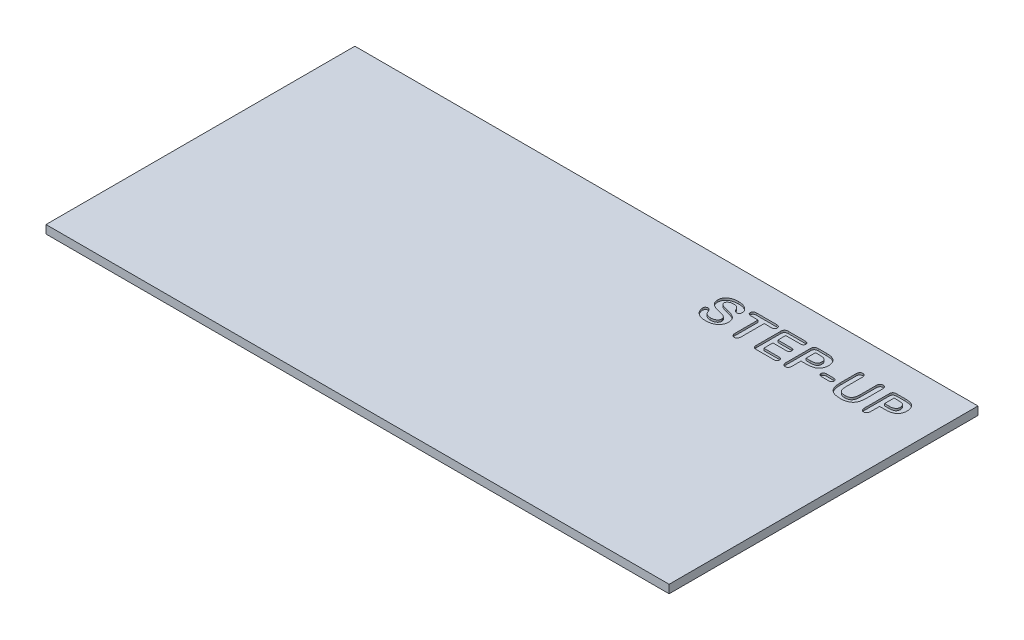
from build123d import *

# Parameters (mm, degrees)
SKETCH1_W           = 150.7
SKETCH1_H           = 74.7
BOSS_EXTRUDE1_DEPTH = 2
CUT_EXTRUDE1_DEPTH  = 0.5


with BuildPart() as part:
    # Sketch1 → Boss-Extrude1 (new body)
    with BuildSketch(Plane(origin=(0, 0, 0), x_dir=(1, 0, 0), z_dir=(0, 1, 0))):
        Rectangle(SKETCH1_W, SKETCH1_H)
    extrude(amount=BOSS_EXTRUDE1_DEPTH)

    # Sketch2 → Cut-Extrude1 (cut)
    # profile 1 of 7: a face of its own
    with BuildSketch(Plane(origin=(0, 2, 0), x_dir=(1, 0, 0), z_dir=(0, 1, 0))):
        with BuildLine():
            Line((64.9625, 25.35), (63.55, 25.35))
            Line((63.55, 25.35), (63.55, 23.1921875))
            add(Edge.make_bspline(
                [(63.55, 23.1921875), (63.548200493, 23.119553799), (63.544788762, 22.981845714), (63.503656267, 22.789754898), (63.438892767, 22.623191348), (63.343819995, 22.487977184), (63.229997001, 22.381456695), (63.100885183, 22.303970658), (62.955999187, 22.259075958), (62.854995107, 22.253079466), (62.803125, 22.25)],
                knots=[0, 0, 0, 0, 1.285699921, 2.437591255, 3.464765735, 4.43309728, 5.341309432, 6.21076238, 7.081146562, 8, 8, 8, 8], degree=3))
            add(Edge.make_bspline(
                [(62.803125, 22.25), (62.74920039, 22.25308367), (62.644665648, 22.259061472), (62.49525059, 22.303168577), (62.3646508, 22.381189563), (62.249753978, 22.485376136), (62.157922353, 22.621124369), (62.094932711, 22.786244519), (62.055618623, 22.977329663), (62.051941587, 23.113850396), (62.05, 23.1859375)],
                knots=[0, 0, 0, 0, 0.952842406, 1.847118322, 2.721986042, 3.621319613, 4.568808427, 5.589565879, 6.727217387, 8, 8, 8, 8], degree=3))
            Line((62.05, 23.1859375), (62.05, 29.0984375))
            add(Edge.make_bspline(
                [(62.05, 29.0984375), (62.050434667, 29.139608427), (62.0512727, 29.21898564), (62.062327203, 29.333930516), (62.08086024, 29.439407853), (62.105682781, 29.536376014), (62.138079603, 29.623387448), (62.177706769, 29.701635998), (62.22437909, 29.770996609), (62.299063449, 29.851444993), (62.41546226, 29.935667862), (62.587166731, 30.003137704), (62.791402515, 30.043149973), (62.93833711, 30.04760778), (63.0171875, 30.05)],
                knots=[0, 0, 0, 0, 0.941718592, 1.815625801, 2.638480297, 3.389986758, 4.102699286, 4.758224476, 5.39283612, 6.008479495, 7.262224214, 8.640906231, 10.197389428, 12, 12, 12, 12], degree=3))
            Line((63.0171875, 30.05), (64.9765625, 30.05))
            add(Edge.make_bspline(
                [(64.9765625, 30.05), (65.046885364, 30.050013455), (65.183413246, 30.050039576), (65.381864387, 30.041288336), (65.567823597, 30.030450008), (65.741539924, 30.017469246), (65.902575257, 29.996991538), (66.050940464, 29.971621683), (66.187435961, 29.944721416), (66.27304116, 29.920825659), (66.3140625, 29.909375)],
                knots=[0, 0, 0, 0, 1.25088383, 2.428520539, 3.533027188, 4.564878591, 5.52680176, 6.419426011, 7.242601342, 8, 8, 8, 8], degree=3))
            add(Edge.make_bspline(
                [(66.3140625, 29.909375), (66.391831182, 29.885701169), (66.544819816, 29.839129374), (66.759841039, 29.738291119), (66.960749687, 29.619783515), (67.142975398, 29.476979443), (67.307320214, 29.31631811), (67.451281035, 29.137644144), (67.573737953, 28.941529386), (67.672789956, 28.727866816), (67.753731375, 28.500678457), (67.80876307, 28.258345702), (67.844578429, 28.002635527), (67.848165585, 27.827209916), (67.85, 27.7375)],
                knots=[0, 0, 0, 0, 1.016072159, 1.998844374, 2.963446839, 3.929479405, 4.88809646, 5.833686282, 6.79396355, 7.773575509, 8.775354313, 9.806098629, 10.878073131, 12, 12, 12, 12], degree=3))
            add(Edge.make_bspline(
                [(67.85, 27.7375), (67.848186591, 27.642588542), (67.844656602, 27.457833472), (67.809027556, 27.189608653), (67.754167819, 26.938409246), (67.673971613, 26.705062612), (67.570735045, 26.489962685), (67.44453727, 26.292889672), (67.296562281, 26.11299441), (67.125271534, 25.951541605), (66.931471429, 25.80885839), (66.715953073, 25.68420262), (66.476441427, 25.582534423), (66.216587393, 25.49561129), (65.933667251, 25.431753168), (65.630083605, 25.382767901), (65.303639546, 25.355079804), (65.078696582, 25.351730247), (64.9625, 25.35)],
                knots=[0, 0, 0, 0, 1.064269092, 2.071710987, 3.030014155, 3.944730477, 4.833317459, 5.700512996, 6.563900655, 7.440202656, 8.334248487, 9.258341999, 10.226640684, 11.248485432, 12.328534365, 13.476518405, 14.696469853, 16, 16, 16, 16], degree=3))
        make_face()
        with BuildLine():
            Line((64.5890625, 28.85), (63.55, 28.85))
            Line((63.55, 28.85), (63.55, 26.55))
            Line((63.55, 26.55), (64.5890625, 26.55))
            add(Edge.make_bspline(
                [(64.5890625, 26.55), (64.676070383, 26.551701706), (64.843043468, 26.554967377), (65.082931449, 26.574020081), (65.300040332, 26.610341656), (65.49605889, 26.657165272), (65.670243096, 26.722262649), (65.822012102, 26.807760466), (65.953696498, 26.909121862), (66.061873063, 27.030552878), (66.148810172, 27.170396855), (66.206396621, 27.331876128), (66.243628028, 27.511853773), (66.247807464, 27.638335228), (66.25, 27.7046875)],
                knots=[0, 0, 0, 0, 1.355309994, 2.600917123, 3.743816141, 4.780660951, 5.735811607, 6.62931006, 7.484500426, 8.311764707, 9.149305958, 10.032284453, 10.967734859, 12, 12, 12, 12], degree=3))
            add(Edge.make_bspline(
                [(66.25, 27.7046875), (66.246635767, 27.784236925), (66.240151616, 27.937558781), (66.183568457, 28.155808259), (66.092761579, 28.353435042), (66.000599113, 28.461694511), (65.9546875, 28.515625)],
                knots=[0, 0, 0, 0, 1.078100798, 2.07790835, 3.042491687, 4, 4, 4, 4], degree=3))
            add(Edge.make_bspline(
                [(65.9546875, 28.515625), (65.924222731, 28.542689382), (65.860176417, 28.599587036), (65.742183143, 28.668263818), (65.601578334, 28.722138275), (65.441841732, 28.772069922), (65.259228002, 28.80584623), (65.055373925, 28.832726413), (64.829392506, 28.847855134), (64.67137475, 28.84926539), (64.5890625, 28.85)],
                knots=[0, 0, 0, 0, 0.67948794, 1.428492636, 2.263733299, 3.191206897, 4.220047442, 5.360670486, 6.625159889, 8, 8, 8, 8], degree=3))
        make_face(mode=Mode.SUBTRACT)
    # profile 2 of 7: a face of its own
    with BuildSketch(Plane(origin=(0, 2, 0), x_dir=(1, 0, 0), z_dir=(0, 1, 0))):
        with BuildLine():
            Line((53.85, 25.5796875), (53.85, 29.3))
            add(Edge.make_bspline(
                [(53.85, 29.3), (53.851843337, 29.374703141), (53.855302094, 29.514872867), (53.895043837, 29.710478107), (53.9572346, 29.877839566), (54.048708577, 30.014282734), (54.160376365, 30.120863014), (54.290957011, 30.195505708), (54.43627969, 30.243580109), (54.539191938, 30.247817776), (54.5921875, 30.25)],
                knots=[0, 0, 0, 0, 1.314006093, 2.465543923, 3.499702682, 4.438645347, 5.334276599, 6.193453487, 7.069703068, 8, 8, 8, 8], degree=3))
            add(Edge.make_bspline(
                [(54.5921875, 30.25), (54.647696923, 30.247019113), (54.75434206, 30.241292211), (54.906078408, 30.196654979), (55.03863166, 30.119805154), (55.151862713, 30.012642849), (55.242251942, 29.874882751), (55.305559719, 29.706490917), (55.344345412, 29.509567433), (55.348043426, 29.368426143), (55.35, 29.29375)],
                knots=[0, 0, 0, 0, 0.96282878, 1.849794185, 2.716851436, 3.599658085, 4.532680285, 5.552030856, 6.704809248, 8, 8, 8, 8], degree=3))
            Line((55.35, 29.29375), (55.35, 25.4640625))
            add(Edge.make_bspline(
                [(55.35, 25.4640625), (55.351774944, 25.359317966), (55.355172118, 25.158841047), (55.381436232, 24.870977327), (55.425807431, 24.609966187), (55.488449908, 24.374193544), (55.576152206, 24.163578501), (55.692749212, 23.97809142), (55.838921849, 23.818102308), (55.982977116, 23.706242941), (56.112687698, 23.632228614), (56.220590251, 23.583609025), (56.337244192, 23.540918823), (56.464340153, 23.509597541), (56.599200895, 23.482092162), (56.743928053, 23.464454093), (56.897657465, 23.450796574), (57.003611758, 23.450269582), (57.0578125, 23.45)],
                knots=[0, 0, 0, 0, 1.640841622, 3.140506311, 4.523579023, 5.784571649, 6.954579444, 8.084197464, 9.198982671, 10.333306227, 10.925380769, 11.535182691, 12.185613052, 12.868404783, 13.583722754, 14.340779317, 15.151228418, 16, 16, 16, 16], degree=3))
            add(Edge.make_bspline(
                [(57.0578125, 23.45), (57.132370733, 23.4513211), (57.276152586, 23.453868775), (57.482935436, 23.478269701), (57.67350243, 23.513929984), (57.846038059, 23.569352845), (58.002792891, 23.637953053), (58.142363883, 23.722119601), (58.265357081, 23.822220398), (58.370819619, 23.938977332), (58.459823018, 24.072767325), (58.538568024, 24.220075314), (58.603472124, 24.383969802), (58.658394028, 24.562521521), (58.700247878, 24.757535373), (58.729253717, 24.968013241), (58.746334888, 25.194509366), (58.748749718, 25.350490531), (58.75, 25.43125)],
                knots=[0, 0, 0, 0, 1.187087794, 2.289239917, 3.312641325, 4.270309596, 5.169103343, 6.032749862, 6.858132282, 7.686303516, 8.528484611, 9.411791075, 10.342302716, 11.33164497, 12.384483705, 13.515514569, 14.713654137, 16, 16, 16, 16], degree=3))
            Line((58.75, 25.43125), (58.75, 29.29375))
            add(Edge.make_bspline(
                [(58.75, 29.29375), (58.752103548, 29.369433717), (58.756050818, 29.511452837), (58.792439742, 29.709785669), (58.856041421, 29.877362487), (58.945463654, 30.014086516), (59.056050082, 30.121820166), (59.18760046, 30.195027826), (59.334100739, 30.243996207), (59.438117705, 30.247946546), (59.4921875, 30.25)],
                knots=[0, 0, 0, 0, 1.324209478, 2.484855026, 3.512713035, 4.440887327, 5.324452051, 6.186293477, 7.057204391, 8, 8, 8, 8], degree=3))
            add(Edge.make_bspline(
                [(59.4921875, 30.25), (59.546217347, 30.247815887), (59.651154252, 30.243573897), (59.799525872, 30.195531154), (59.932599225, 30.121409666), (60.046892769, 30.015500909), (60.141288031, 29.880021364), (60.205762319, 29.711383258), (60.244372526, 29.513736518), (60.248048647, 29.372072739), (60.25, 29.296875)],
                knots=[0, 0, 0, 0, 0.937671153, 1.821147261, 2.686184232, 3.571984669, 4.510357278, 5.535961965, 6.692043289, 8, 8, 8, 8], degree=3))
            Line((60.25, 29.296875), (60.25, 25.5625))
            add(Edge.make_bspline(
                [(60.25, 25.5625), (60.247896087, 25.417136545), (60.243856429, 25.138028666), (60.213572353, 24.738116806), (60.160619704, 24.375823771), (60.089048273, 24.046643352), (59.985211843, 23.744758349), (59.842423333, 23.465424496), (59.66296704, 23.203815396), (59.516271864, 23.049704479), (59.4421875, 22.971875)],
                knots=[0, 0, 0, 0, 1.248457049, 2.397123805, 3.441600438, 4.391152342, 5.286682789, 6.174943873, 7.078305605, 8, 8, 8, 8], degree=3))
            add(Edge.make_bspline(
                [(59.4421875, 22.971875), (59.371093093, 22.911812763), (59.229070693, 22.791828879), (58.992406933, 22.642737173), (58.740548023, 22.516074488), (58.470029614, 22.416084523), (58.179287903, 22.341240921), (57.866615872, 22.289261711), (57.530936875, 22.255710642), (57.299042666, 22.251940486), (57.1796875, 22.25)],
                knots=[0, 0, 0, 0, 0.917673777, 1.83319953, 2.752815171, 3.696261941, 4.673826777, 5.7116717, 6.822205161, 8, 8, 8, 8], degree=3))
            add(Edge.make_bspline(
                [(57.1796875, 22.25), (57.037934366, 22.252312684), (56.764362257, 22.256775978), (56.369211286, 22.293274114), (56.004144416, 22.350814054), (55.669385632, 22.435267527), (55.363186307, 22.543112744), (55.088641097, 22.682513803), (54.839596471, 22.842820489), (54.622239148, 23.034364877), (54.432784837, 23.252527622), (54.270062759, 23.498498653), (54.138742697, 23.77450846), (54.029268658, 24.077191703), (53.950736271, 24.410481931), (53.890683283, 24.772633299), (53.857481503, 25.166052574), (53.852553985, 25.43848362), (53.85, 25.5796875)],
                knots=[0, 0, 0, 0, 1.244583114, 2.401944964, 3.48169555, 4.486712429, 5.430003149, 6.325898902, 7.184706889, 8.024138875, 8.860562605, 9.715550095, 10.605366032, 11.538500779, 12.536866304, 13.60758979, 14.759988597, 16, 16, 16, 16], degree=3))
        make_face()
    # profile 3 of 7: a face of its own
    with BuildSketch(Plane(origin=(0, 2, 0), x_dir=(1, 0, 0), z_dir=(0, 1, 0))):
        with BuildLine():
            Line((51.978125, 24.55), (50.321875, 24.55))
            add(Edge.make_bspline(
                [(50.321875, 24.55), (50.262325989, 24.551903263), (50.150117822, 24.555489581), (49.993008655, 24.587020776), (49.856901719, 24.637125092), (49.746189928, 24.712209311), (49.658152828, 24.801878549), (49.595993321, 24.906479399), (49.556591176, 25.022779858), (49.552229926, 25.104891152), (49.55, 25.146875)],
                knots=[0, 0, 0, 0, 1.299805928, 2.449223535, 3.486898841, 4.446433637, 5.347856832, 6.21051608, 7.085029387, 8, 8, 8, 8], degree=3))
            add(Edge.make_bspline(
                [(49.55, 25.146875), (49.552355315, 25.189843141), (49.556925941, 25.27322531), (49.593749185, 25.39155723), (49.65554407, 25.495965726), (49.73918911, 25.588263853), (49.849908062, 25.663490392), (49.986824065, 25.712869249), (50.146462016, 25.744735894), (50.260757015, 25.748165862), (50.321875, 25.75)],
                knots=[0, 0, 0, 0, 0.930252909, 1.805209739, 2.655335837, 3.542447437, 4.485088836, 5.525143206, 6.676597728, 8, 8, 8, 8], degree=3))
            Line((50.321875, 25.75), (51.978125, 25.75))
            add(Edge.make_bspline(
                [(51.978125, 25.75), (52.039236604, 25.748143103), (52.15351967, 25.744670574), (52.312757112, 25.713177265), (52.448988312, 25.6631708), (52.559208584, 25.58777455), (52.644544874, 25.496517209), (52.706178204, 25.391491218), (52.743093788, 25.273243246), (52.747651394, 25.18984924), (52.75, 25.146875)],
                knots=[0, 0, 0, 0, 1.32387857, 2.475747504, 3.505638844, 4.448619502, 5.343708498, 6.194140559, 7.06941229, 8, 8, 8, 8], degree=3))
            add(Edge.make_bspline(
                [(52.75, 25.146875), (52.747456291, 25.104987728), (52.742500363, 25.023378415), (52.707796904, 24.906261858), (52.646392865, 24.802581798), (52.561812167, 24.71173251), (52.452082557, 24.636866251), (52.315421275, 24.586569432), (52.155050269, 24.55539333), (52.039749514, 24.551878541), (51.978125, 24.55)],
                knots=[0, 0, 0, 0, 0.911547891, 1.775976195, 2.629630521, 3.512087315, 4.458640903, 5.492434473, 6.659787555, 8, 8, 8, 8], degree=3))
        make_face()
    # profile 4 of 7: a face of its own
    with BuildSketch(Plane(origin=(0, 2, 0), x_dir=(1, 0, 0), z_dir=(0, 1, 0))):
        with BuildLine():
            Line((45.9625, 25.35), (44.55, 25.35))
            Line((44.55, 25.35), (44.55, 23.1921875))
            add(Edge.make_bspline(
                [(44.55, 23.1921875), (44.548200493, 23.119553799), (44.544788762, 22.981845714), (44.503656267, 22.789754898), (44.438892767, 22.623191348), (44.343819995, 22.487977184), (44.229997001, 22.381456695), (44.100885183, 22.303970658), (43.955999187, 22.259075958), (43.854995107, 22.253079466), (43.803125, 22.25)],
                knots=[0, 0, 0, 0, 1.285699921, 2.437591255, 3.464765735, 4.43309728, 5.341309432, 6.21076238, 7.081146562, 8, 8, 8, 8], degree=3))
            add(Edge.make_bspline(
                [(43.803125, 22.25), (43.74920039, 22.25308367), (43.644665648, 22.259061472), (43.49525059, 22.303168577), (43.3646508, 22.381189563), (43.249753978, 22.485376136), (43.157922353, 22.621124369), (43.094932711, 22.786244519), (43.055618623, 22.977329663), (43.051941587, 23.113850396), (43.05, 23.1859375)],
                knots=[0, 0, 0, 0, 0.952842406, 1.847118322, 2.721986042, 3.621319613, 4.568808427, 5.589565879, 6.727217387, 8, 8, 8, 8], degree=3))
            Line((43.05, 23.1859375), (43.05, 29.0984375))
            add(Edge.make_bspline(
                [(43.05, 29.0984375), (43.050434667, 29.139608427), (43.0512727, 29.21898564), (43.062327203, 29.333930516), (43.08086024, 29.439407853), (43.105682781, 29.536376014), (43.138079603, 29.623387448), (43.177706769, 29.701635998), (43.22437909, 29.770996609), (43.299063449, 29.851444993), (43.41546226, 29.935667862), (43.587166731, 30.003137704), (43.791402515, 30.043149973), (43.93833711, 30.04760778), (44.0171875, 30.05)],
                knots=[0, 0, 0, 0, 0.941718592, 1.815625801, 2.638480297, 3.389986758, 4.102699286, 4.758224476, 5.39283612, 6.008479495, 7.262224214, 8.640906231, 10.197389428, 12, 12, 12, 12], degree=3))
            Line((44.0171875, 30.05), (45.9765625, 30.05))
            add(Edge.make_bspline(
                [(45.9765625, 30.05), (46.046885364, 30.050013455), (46.183413246, 30.050039576), (46.381864387, 30.041288336), (46.567823597, 30.030450008), (46.741539924, 30.017469246), (46.902575257, 29.996991538), (47.050940464, 29.971621683), (47.187435961, 29.944721416), (47.27304116, 29.920825659), (47.3140625, 29.909375)],
                knots=[0, 0, 0, 0, 1.25088383, 2.428520539, 3.533027188, 4.564878591, 5.52680176, 6.419426011, 7.242601342, 8, 8, 8, 8], degree=3))
            add(Edge.make_bspline(
                [(47.3140625, 29.909375), (47.391831182, 29.885701169), (47.544819816, 29.839129374), (47.759841039, 29.738291119), (47.960749687, 29.619783515), (48.142975398, 29.476979443), (48.307320214, 29.31631811), (48.451281035, 29.137644144), (48.573737953, 28.941529386), (48.672789956, 28.727866816), (48.753731375, 28.500678457), (48.80876307, 28.258345702), (48.844578429, 28.002635527), (48.848165585, 27.827209916), (48.85, 27.7375)],
                knots=[0, 0, 0, 0, 1.016072159, 1.998844374, 2.963446839, 3.929479405, 4.88809646, 5.833686282, 6.79396355, 7.773575509, 8.775354313, 9.806098629, 10.878073131, 12, 12, 12, 12], degree=3))
            add(Edge.make_bspline(
                [(48.85, 27.7375), (48.848186591, 27.642588542), (48.844656602, 27.457833472), (48.809027556, 27.189608653), (48.754167819, 26.938409246), (48.673971613, 26.705062612), (48.570735045, 26.489962685), (48.44453727, 26.292889672), (48.296562281, 26.11299441), (48.125271534, 25.951541605), (47.931471429, 25.80885839), (47.715953073, 25.68420262), (47.476441427, 25.582534423), (47.216587393, 25.49561129), (46.933667251, 25.431753168), (46.630083605, 25.382767901), (46.303639546, 25.355079804), (46.078696582, 25.351730247), (45.9625, 25.35)],
                knots=[0, 0, 0, 0, 1.064269092, 2.071710987, 3.030014155, 3.944730477, 4.833317459, 5.700512996, 6.563900655, 7.440202656, 8.334248487, 9.258341999, 10.226640684, 11.248485432, 12.328534365, 13.476518405, 14.696469853, 16, 16, 16, 16], degree=3))
        make_face()
        with BuildLine():
            Line((45.5890625, 28.85), (44.55, 28.85))
            Line((44.55, 28.85), (44.55, 26.55))
            Line((44.55, 26.55), (45.5890625, 26.55))
            add(Edge.make_bspline(
                [(45.5890625, 26.55), (45.676070383, 26.551701706), (45.843043468, 26.554967377), (46.082931449, 26.574020081), (46.300040332, 26.610341656), (46.49605889, 26.657165272), (46.670243096, 26.722262649), (46.822012102, 26.807760466), (46.953696498, 26.909121862), (47.061873063, 27.030552878), (47.148810172, 27.170396855), (47.206396621, 27.331876128), (47.243628028, 27.511853773), (47.247807464, 27.638335228), (47.25, 27.7046875)],
                knots=[0, 0, 0, 0, 1.355309994, 2.600917123, 3.743816141, 4.780660951, 5.735811607, 6.62931006, 7.484500426, 8.311764707, 9.149305958, 10.032284453, 10.967734859, 12, 12, 12, 12], degree=3))
            add(Edge.make_bspline(
                [(47.25, 27.7046875), (47.246635767, 27.784236925), (47.240151616, 27.937558781), (47.183568457, 28.155808259), (47.092761579, 28.353435042), (47.000599113, 28.461694511), (46.9546875, 28.515625)],
                knots=[0, 0, 0, 0, 1.078100798, 2.07790835, 3.042491687, 4, 4, 4, 4], degree=3))
            add(Edge.make_bspline(
                [(46.9546875, 28.515625), (46.924222731, 28.542689382), (46.860176417, 28.599587036), (46.742183143, 28.668263818), (46.601578334, 28.722138275), (46.441841732, 28.772069922), (46.259228002, 28.80584623), (46.055373925, 28.832726413), (45.829392506, 28.847855134), (45.67137475, 28.84926539), (45.5890625, 28.85)],
                knots=[0, 0, 0, 0, 0.67948794, 1.428492636, 2.263733299, 3.191206897, 4.220047442, 5.360670486, 6.625159889, 8, 8, 8, 8], degree=3))
        make_face(mode=Mode.SUBTRACT)
    # profile 5 of 7: a face of its own
    with BuildSketch(Plane(origin=(0, 2, 0), x_dir=(1, 0, 0), z_dir=(0, 1, 0))):
        with BuildLine():
            Line((40.878125, 28.85), (37.35, 28.85))
            Line((37.35, 28.85), (37.35, 26.95))
            Line((37.35, 26.95), (40.5984375, 26.95))
            add(Edge.make_bspline(
                [(40.5984375, 26.95), (40.654808283, 26.947866606), (40.760619514, 26.943862103), (40.908735191, 26.915536651), (41.033999736, 26.863546668), (41.135907692, 26.790996382), (41.214173465, 26.700761291), (41.271706533, 26.597893551), (41.305341496, 26.480165366), (41.309023021, 26.397615403), (41.3109375, 26.3546875)],
                knots=[0, 0, 0, 0, 1.285293232, 2.412569968, 3.418386025, 4.354403319, 5.23810445, 6.120527863, 7.022630715, 8, 8, 8, 8], degree=3))
            add(Edge.make_bspline(
                [(41.3109375, 26.3546875), (41.309076808, 26.311733294), (41.305498714, 26.22913275), (41.271079409, 26.111555816), (41.215670117, 26.006526708), (41.138153342, 25.914393747), (41.037089175, 25.839168055), (40.911507056, 25.785881982), (40.762348096, 25.755721734), (40.655353341, 25.751986798), (40.5984375, 25.75)],
                knots=[0, 0, 0, 0, 0.971200242, 1.867609123, 2.749214551, 3.645234956, 4.57279535, 5.576919765, 6.711042891, 8, 8, 8, 8], degree=3))
            Line((40.5984375, 25.75), (37.35, 25.75))
            Line((37.35, 25.75), (37.35, 23.55))
            Line((37.35, 23.55), (41, 23.55))
            add(Edge.make_bspline(
                [(41, 23.55), (41.057921056, 23.547832714), (41.166806448, 23.543758448), (41.320281315, 23.515623535), (41.450341207, 23.4621797), (41.557739329, 23.389015476), (41.642612592, 23.299215593), (41.700991963, 23.192434212), (41.73891324, 23.073371804), (41.742105854, 22.988843341), (41.74375, 22.9453125)],
                knots=[0, 0, 0, 0, 1.281412047, 2.408917619, 3.431661904, 4.368016538, 5.264760761, 6.136510243, 7.040331808, 8, 8, 8, 8], degree=3))
            add(Edge.make_bspline(
                [(41.74375, 22.9453125), (41.742191646, 22.90278967), (41.739184528, 22.820734408), (41.70030769, 22.705092373), (41.642190584, 22.60050829), (41.557722269, 22.511097277), (41.450702936, 22.437376187), (41.31967536, 22.386877569), (41.167095907, 22.35549324), (41.057985531, 22.351906261), (41, 22.35)],
                knots=[0, 0, 0, 0, 0.944744106, 1.823049547, 2.692159438, 3.596595969, 4.540982691, 5.5681055, 6.707595947, 8, 8, 8, 8], degree=3))
            Line((41, 22.35), (36.76875, 22.35))
            add(Edge.make_bspline(
                [(36.76875, 22.35), (36.692475037, 22.352219706), (36.550535707, 22.356350336), (36.353879542, 22.398310057), (36.18996276, 22.467712994), (36.05747362, 22.569815024), (35.961692234, 22.708460997), (35.894820923, 22.878233228), (35.857526723, 23.081749071), (35.852624476, 23.227969299), (35.85, 23.30625)],
                knots=[0, 0, 0, 0, 1.189456171, 2.21344733, 3.119993849, 3.948013107, 4.78741338, 5.71757596, 6.778077714, 8, 8, 8, 8], degree=3))
            Line((35.85, 23.30625), (35.85, 29.09375))
            add(Edge.make_bspline(
                [(35.85, 29.09375), (35.851201262, 29.147445357), (35.853482324, 29.249406838), (35.870448113, 29.394954422), (35.899314995, 29.525262549), (35.941782749, 29.640932339), (35.996000542, 29.742745589), (36.066313479, 29.828913881), (36.150345927, 29.899741117), (36.247397964, 29.957205241), (36.358881578, 29.998291889), (36.482794666, 30.030258142), (36.62146653, 30.046211421), (36.71819793, 30.048699647), (36.76875, 30.05)],
                knots=[0, 0, 0, 0, 1.257097402, 2.387087425, 3.425508426, 4.374733264, 5.264346199, 6.113849079, 6.961774747, 7.825601221, 8.740599092, 9.73444991, 10.816017894, 12, 12, 12, 12], degree=3))
            Line((36.76875, 30.05), (40.878125, 30.05))
            add(Edge.make_bspline(
                [(40.878125, 30.05), (40.936547132, 30.047786723), (41.046428114, 30.043623967), (41.20070829, 30.016198256), (41.329929303, 29.962007982), (41.436282782, 29.889626428), (41.516268309, 29.798524894), (41.577029837, 29.695816642), (41.6115646, 29.57819476), (41.615281148, 29.495527854), (41.6171875, 29.453125)],
                knots=[0, 0, 0, 0, 1.304353081, 2.453241492, 3.474309848, 4.409392115, 5.298405909, 6.157667996, 7.055001114, 8, 8, 8, 8], degree=3))
            add(Edge.make_bspline(
                [(41.6171875, 29.453125), (41.615355602, 29.409658237), (41.61180473, 29.325404151), (41.576561889, 29.205598616), (41.517302813, 29.100325512), (41.436117896, 29.008990145), (41.330317299, 28.936073028), (41.200273997, 28.88431663), (41.046500227, 28.856208719), (40.936572164, 28.852155198), (40.878125, 28.85)],
                knots=[0, 0, 0, 0, 0.962139494, 1.864969442, 2.738963821, 3.622448103, 4.551714319, 5.562017248, 6.70375977, 8, 8, 8, 8], degree=3))
        make_face()
    # profile 6 of 7: a face of its own
    with BuildSketch(Plane(origin=(0, 2, 0), x_dir=(1, 0, 0), z_dir=(0, 1, 0))):
        with BuildLine():
            Line((33.9578125, 28.75), (32.25, 28.75))
            Line((32.25, 28.75), (32.25, 23.19375))
            add(Edge.make_bspline(
                [(32.25, 23.19375), (32.248148683, 23.118535681), (32.244686184, 22.97786313), (32.205288163, 22.781404942), (32.141477772, 22.614492132), (32.048549707, 22.479737946), (31.935904267, 22.375968674), (31.805825861, 22.302721538), (31.66031622, 22.256840006), (31.557641248, 22.252327359), (31.5046875, 22.25)],
                knots=[0, 0, 0, 0, 1.324771526, 2.4777063, 3.516495944, 4.454151167, 5.338361256, 6.19400724, 7.068574513, 8, 8, 8, 8], degree=3))
            add(Edge.make_bspline(
                [(31.5046875, 22.25), (31.451142683, 22.252124623), (31.34715597, 22.256250747), (31.200563979, 22.305181765), (31.066914435, 22.376697952), (30.953295254, 22.483117179), (30.858625993, 22.617658023), (30.796912448, 22.785554926), (30.754827435, 22.97968454), (30.751673905, 23.119523156), (30.75, 23.19375)],
                knots=[0, 0, 0, 0, 0.936591527, 1.818907611, 2.686883908, 3.580272073, 4.52668274, 5.549195867, 6.699104295, 8, 8, 8, 8], degree=3))
            Line((30.75, 23.19375), (30.75, 28.75))
            Line((30.75, 28.75), (29.040625, 28.75))
            add(Edge.make_bspline(
                [(29.040625, 28.75), (28.977905618, 28.751556279), (28.860231213, 28.754476178), (28.696906818, 28.789852284), (28.556740423, 28.842988626), (28.443325711, 28.922921396), (28.356539538, 29.021221203), (28.29315205, 29.133869266), (28.257079634, 29.261375609), (28.252406376, 29.350818595), (28.25, 29.396875)],
                knots=[0, 0, 0, 0, 1.298175259, 2.435642608, 3.448405227, 4.386245553, 5.281324188, 6.14672195, 7.045701294, 8, 8, 8, 8], degree=3))
            add(Edge.make_bspline(
                [(28.25, 29.396875), (28.252003331, 29.445113421), (28.255866362, 29.538131793), (28.29667311, 29.668486726), (28.360181417, 29.783764012), (28.451502619, 29.879883878), (28.566220724, 29.95798555), (28.705087679, 30.011772948), (28.865644078, 30.044805548), (28.980029663, 30.048201178), (29.040625, 30.05)],
                knots=[0, 0, 0, 0, 0.993926626, 1.916593339, 2.793690024, 3.692250099, 4.629614642, 5.63892321, 6.749228366, 8, 8, 8, 8], degree=3))
            Line((29.040625, 30.05), (33.9578125, 30.05))
            add(Edge.make_bspline(
                [(33.9578125, 30.05), (34.021559191, 30.048386745), (34.14126913, 30.045357212), (34.307509792, 30.01065929), (34.449519021, 29.955899164), (34.562318061, 29.873323553), (34.652113655, 29.77610947), (34.713727111, 29.661365636), (34.753058231, 29.533799084), (34.757222549, 29.443532148), (34.759375, 29.396875)],
                knots=[0, 0, 0, 0, 1.304496451, 2.449714448, 3.464685333, 4.39788137, 5.28974218, 6.154486031, 7.046091257, 8, 8, 8, 8], degree=3))
            add(Edge.make_bspline(
                [(34.759375, 29.396875), (34.757109889, 29.350784207), (34.752703748, 29.261127431), (34.714520318, 29.133710702), (34.649633141, 29.021124348), (34.561248062, 28.922855601), (34.446290994, 28.842994176), (34.304147791, 28.789615927), (34.139182525, 28.754757885), (34.020516423, 28.751644914), (33.9578125, 28.75)],
                knots=[0, 0, 0, 0, 0.94771637, 1.843517728, 2.708217129, 3.604275273, 4.544436114, 5.560171289, 6.710778986, 8, 8, 8, 8], degree=3))
        make_face()
    # profile 7 of 7: a face of its own
    with BuildSketch(Plane(origin=(0, 2, 0), x_dir=(1, 0, 0), z_dir=(0, 1, 0))):
        with BuildLine():
            add(Edge.make_bspline(
                [(27.65, 24.7453125), (27.648712959, 24.686416555), (27.646167584, 24.569938389), (27.628509982, 24.397671378), (27.600432282, 24.230117752), (27.561760436, 24.066900576), (27.509729615, 23.908872593), (27.446618288, 23.755095981), (27.374141886, 23.60483796), (27.286963065, 23.461035693), (27.191359314, 23.322467836), (27.083620941, 23.191909741), (26.967177823, 23.068069697), (26.837487705, 22.953924206), (26.698793161, 22.846246473), (26.549672126, 22.745719978), (26.389794227, 22.653595024), (26.219786488, 22.56929911), (26.040078479, 22.494579849), (25.852178057, 22.429255194), (25.656559057, 22.371615173), (25.451743436, 22.330133497), (25.239992232, 22.292461342), (25.019167025, 22.268767564), (24.790360918, 22.252150199), (24.634927741, 22.250722618), (24.55625, 22.25)],
                knots=[0, 0, 0, 0, 0.94904565, 1.876922008, 2.787632434, 3.685409961, 4.577243309, 5.465673456, 6.362823001, 7.262481841, 8.172882791, 9.073480814, 9.987781212, 10.909257821, 11.854472834, 12.815908446, 13.804938933, 14.825933836, 15.871877953, 16.938992789, 18.030809531, 19.155177508, 20.304610591, 21.495671913, 22.732349945, 24, 24, 24, 24], degree=3))
            add(Edge.make_bspline(
                [(24.55625, 22.25), (24.462474107, 22.251766251), (24.278349903, 22.255234195), (24.008422299, 22.274556492), (23.751464319, 22.311477218), (23.506290894, 22.358903044), (23.273828062, 22.422704047), (23.054537895, 22.501760385), (22.846183667, 22.590786663), (22.717062091, 22.664875803), (22.653125, 22.7015625)],
                knots=[0, 0, 0, 0, 1.136969792, 2.232382444, 3.278022597, 4.282276305, 5.258039159, 6.196692155, 7.1070566, 8, 8, 8, 8], degree=3))
            add(Edge.make_bspline(
                [(22.653125, 22.7015625), (22.570260974, 22.756212978), (22.405385002, 22.864951971), (22.186628197, 23.066016783), (21.987559492, 23.288021359), (21.818700513, 23.534109002), (21.680389778, 23.790234771), (21.578610118, 24.047893376), (21.515927044, 24.303267459), (21.507331988, 24.473115255), (21.503125, 24.55625)],
                knots=[0, 0, 0, 0, 1.048405233, 2.086029851, 3.131870059, 4.19698972, 5.234628962, 6.204463721, 7.121145791, 8, 8, 8, 8], degree=3))
            add(Edge.make_bspline(
                [(21.503125, 24.55625), (21.505500875, 24.602848128), (21.510141108, 24.693857185), (21.547381887, 24.824573551), (21.608344767, 24.944021763), (21.690355948, 25.051721491), (21.793128258, 25.140577725), (21.911166606, 25.205880141), (22.042625734, 25.247125435), (22.135104417, 25.25108324), (22.1828125, 25.253125)],
                knots=[0, 0, 0, 0, 1.029346977, 2.010378973, 2.978887221, 3.98112847, 4.985683985, 5.960201932, 6.947705008, 8, 8, 8, 8], degree=3))
            add(Edge.make_bspline(
                [(22.1828125, 25.253125), (22.221575716, 25.251619621), (22.296699953, 25.248702153), (22.40454571, 25.217270865), (22.502657412, 25.166744282), (22.591437191, 25.09551993), (22.673327499, 25.00725768), (22.746532653, 24.898385902), (22.815763114, 24.772248143), (22.852619397, 24.678609241), (22.871875, 24.6296875)],
                knots=[0, 0, 0, 0, 0.932433643, 1.807083439, 2.683354794, 3.577798377, 4.537574086, 5.575745438, 6.73344572, 8, 8, 8, 8], degree=3))
            add(Edge.make_bspline(
                [(22.871875, 24.6296875), (22.897469659, 24.570639719), (22.946870812, 24.456669515), (23.025795442, 24.294449777), (23.111430698, 24.149635577), (23.196447405, 24.015142896), (23.295238615, 23.894548966), (23.412669399, 23.788460724), (23.546302728, 23.690824068), (23.699013441, 23.604052653), (23.873699625, 23.532377551), (24.074183049, 23.4863995), (24.297363258, 23.45366496), (24.455069827, 23.451258047), (24.5375, 23.45)],
                knots=[0, 0, 0, 0, 1.049400523, 2.025484958, 2.938775158, 3.791458515, 4.617854192, 5.471340711, 6.364831691, 7.311813007, 8.329001391, 9.430967745, 10.65721654, 12, 12, 12, 12], degree=3))
            add(Edge.make_bspline(
                [(24.5375, 23.45), (24.59587672, 23.450704912), (24.710247005, 23.45208596), (24.877165585, 23.468586082), (25.03616907, 23.492577459), (25.185551379, 23.529496663), (25.328153582, 23.571924491), (25.460753804, 23.629310958), (25.586089269, 23.694350994), (25.701619031, 23.769330441), (25.806253904, 23.851967595), (25.898670489, 23.940259314), (25.976149101, 24.034884402), (26.038816492, 24.134383647), (26.090293015, 24.237455191), (26.123604798, 24.346900673), (26.14753714, 24.460417196), (26.149169013, 24.538409536), (26.15, 24.578125)],
                knots=[0, 0, 0, 0, 1.280104897, 2.507951138, 3.676307556, 4.80418709, 5.881088807, 6.935759984, 7.968101261, 8.975871649, 9.951925376, 10.889226907, 11.77430911, 12.626938706, 13.464975202, 14.292430499, 15.130466995, 16, 16, 16, 16], degree=3))
            add(Edge.make_bspline(
                [(26.15, 24.578125), (26.147163147, 24.639380696), (26.141694677, 24.757460453), (26.095038902, 24.924947316), (26.018954629, 25.074760242), (25.909609626, 25.202901583), (25.778573621, 25.31506696), (25.629577509, 25.413951212), (25.461953745, 25.496363135), (25.275237274, 25.567285702), (25.063175966, 25.629960302), (24.823055091, 25.698226874), (24.549375699, 25.763796465), (24.356287844, 25.807993886), (24.2546875, 25.83125)],
                knots=[0, 0, 0, 0, 0.889216893, 1.714102054, 2.506617733, 3.313297162, 4.145346194, 5.008548814, 5.905982136, 6.85524107, 7.90915739, 9.119934543, 10.484546625, 12, 12, 12, 12], degree=3))
            add(Edge.make_bspline(
                [(24.2546875, 25.83125), (24.121570221, 25.863946459), (23.865384971, 25.926871053), (23.500806312, 26.036170323), (23.170220768, 26.153528031), (22.869789851, 26.276775336), (22.60105202, 26.419257641), (22.361682967, 26.58421778), (22.153358078, 26.774545525), (22.001804853, 26.951223997), (21.899985809, 27.105476199), (21.831932302, 27.227728242), (21.775939149, 27.357687964), (21.730819577, 27.49434549), (21.694924187, 27.636927841), (21.668053724, 27.786141205), (21.652279102, 27.942363632), (21.650768427, 28.048922359), (21.65, 28.103125)],
                knots=[0, 0, 0, 0, 1.736501148, 3.341910126, 4.819600125, 6.179978285, 7.452384316, 8.666026066, 9.852526874, 11.018500134, 11.604160195, 12.191898388, 12.788898658, 13.394048862, 14.013423104, 14.650267458, 15.313438986, 16, 16, 16, 16], degree=3))
            add(Edge.make_bspline(
                [(21.65, 28.103125), (21.650557975, 28.155273407), (21.651660409, 28.258307091), (21.670808909, 28.410511925), (21.695427828, 28.558899226), (21.736279271, 28.701905522), (21.783972236, 28.841228762), (21.843322949, 28.976526062), (21.916120515, 29.105645601), (21.99674673, 29.231389453), (22.089602208, 29.349846173), (22.191405128, 29.463165542), (22.303826104, 29.569173346), (22.42597173, 29.667262016), (22.556413512, 29.759062607), (22.69798423, 29.841681318), (22.849199834, 29.917426381), (23.064954682, 30.013506377), (23.357496699, 30.1091081), (23.733154434, 30.192171103), (24.138353416, 30.240032524), (24.41810321, 30.246606665), (24.5625, 30.25)],
                knots=[0, 0, 0, 0, 0.769447055, 1.520256708, 2.262508943, 2.988321943, 3.713156319, 4.436274914, 5.166110871, 5.89994773, 6.639925254, 7.385953261, 8.147635144, 8.918771606, 9.697541001, 10.500837489, 11.336648996, 12.194084557, 13.986552036, 15.869357873, 17.867910982, 20, 20, 20, 20], degree=3))
            add(Edge.make_bspline(
                [(24.5625, 30.25), (24.677689291, 30.248067381), (24.900233702, 30.244333582), (25.222041094, 30.211050863), (25.51967547, 30.157517899), (25.793210734, 30.081066548), (26.042014979, 29.98376068), (26.272129344, 29.878311201), (26.477092235, 29.751859597), (26.660412441, 29.614448897), (26.820575498, 29.468466537), (26.958089465, 29.317194564), (27.073241338, 29.162762549), (27.163600717, 29.004002626), (27.234733798, 28.846031446), (27.285130506, 28.688867706), (27.316612929, 28.533036891), (27.32013646, 28.429306479), (27.321875, 28.378125)],
                knots=[0, 0, 0, 0, 1.501690988, 2.90125006, 4.213360721, 5.441058994, 6.597662568, 7.694391675, 8.736870916, 9.731158549, 10.678212085, 11.558107852, 12.393499291, 13.184506524, 13.935459515, 14.648542639, 15.3331793, 16, 16, 16, 16], degree=3))
            add(Edge.make_bspline(
                [(27.321875, 28.378125), (27.319432994, 28.332571118), (27.314610545, 28.242611752), (27.276974316, 28.11143357), (27.214868843, 27.988512615), (27.131267051, 27.875619206), (27.030307317, 27.778859958), (26.912963129, 27.708258224), (26.783339159, 27.663619314), (26.692030332, 27.658744289), (26.6453125, 27.65625)],
                knots=[0, 0, 0, 0, 0.996822281, 1.968514991, 2.963507279, 3.999520829, 5.032703306, 6.005199511, 6.979367534, 8, 8, 8, 8], degree=3))
            add(Edge.make_bspline(
                [(26.6453125, 27.65625), (26.604052264, 27.657672268), (26.526093726, 27.660359552), (26.416871985, 27.682201951), (26.322508486, 27.717533855), (26.241790411, 27.770713094), (26.170238395, 27.841485817), (26.099187665, 27.928849367), (26.021725922, 28.031417296), (25.973821219, 28.108928437), (25.9484375, 28.15)],
                knots=[0, 0, 0, 0, 1.091449335, 2.062222683, 2.935356023, 3.742291246, 4.60049062, 5.589116983, 6.722522559, 8, 8, 8, 8], degree=3))
            add(Edge.make_bspline(
                [(25.9484375, 28.15), (25.911821519, 28.225224116), (25.841167488, 28.37037623), (25.715776953, 28.569079862), (25.577208096, 28.739864829), (25.453238141, 28.865399795), (25.343902022, 28.951794536), (25.248495726, 29.00451546), (25.14243093, 29.049058785), (25.02562645, 29.0874488), (24.896655194, 29.114625363), (24.756235808, 29.134618907), (24.604389632, 29.147192337), (24.499503869, 29.149043539), (24.4453125, 29.15)],
                knots=[0, 0, 0, 0, 1.547925219, 2.986869477, 4.337480217, 5.612327564, 6.244828973, 6.909713596, 7.622436063, 8.372459485, 9.181850378, 10.058552105, 10.996911345, 12, 12, 12, 12], degree=3))
            add(Edge.make_bspline(
                [(24.4453125, 29.15), (24.345648457, 29.146695355), (24.155452033, 29.14038885), (23.884136886, 29.093103077), (23.643703113, 29.008202865), (23.467230454, 28.910254132), (23.344085398, 28.820259076), (23.266470636, 28.748099722), (23.198932995, 28.674440035), (23.145858563, 28.595449702), (23.103359103, 28.51371907), (23.070701209, 28.428664668), (23.054179631, 28.339180111), (23.051393898, 28.27869997), (23.05, 28.2484375)],
                knots=[0, 0, 0, 0, 1.954508865, 3.729936959, 5.377867423, 6.932763574, 7.670377485, 8.364471239, 9.008409927, 9.626125187, 10.224705099, 10.812996495, 11.406058616, 12, 12, 12, 12], degree=3))
            add(Edge.make_bspline(
                [(23.05, 28.2484375), (23.051325015, 28.211312295), (23.053932378, 28.138257324), (23.079668801, 28.0331149), (23.121231053, 27.935712787), (23.177939794, 27.84580504), (23.250610418, 27.764499739), (23.337027553, 27.691620713), (23.431411, 27.619927838), (23.576690016, 27.538815264), (23.766000399, 27.450180906), (23.968804927, 27.379813754), (24.151802343, 27.330700409), (24.326584381, 27.286029039), (24.538612276, 27.230494142), (24.693151097, 27.193438215), (24.7765625, 27.1734375)],
                knots=[0, 0, 0, 0, 0.710476229, 1.398074961, 2.059979244, 2.732930957, 3.425942516, 4.140543967, 4.897202213, 5.693324271, 7.323324828, 8.898613798, 9.799484583, 10.954336094, 12.356121149, 14, 14, 14, 14], degree=3))
            add(Edge.make_bspline(
                [(24.7765625, 27.1734375), (24.882929579, 27.147862275), (25.091009812, 27.09783083), (25.394854505, 27.016428), (25.683248117, 26.931242825), (25.955884846, 26.840330961), (26.211717691, 26.745716445), (26.447351758, 26.638541884), (26.663799847, 26.523593742), (26.861109456, 26.397121633), (27.037522061, 26.255164884), (27.196054374, 26.098880058), (27.330610355, 25.921841446), (27.445675815, 25.72827661), (27.539897976, 25.515015029), (27.604354961, 25.278133045), (27.643863697, 25.01904351), (27.647906684, 24.838692116), (27.65, 24.7453125)],
                knots=[0, 0, 0, 0, 1.267502217, 2.479546844, 3.644246111, 4.751070339, 5.809111578, 6.802976886, 7.747931384, 8.64678748, 9.513844361, 10.367269951, 11.219414442, 12.082556445, 12.971635876, 13.911644553, 14.918722911, 16, 16, 16, 16], degree=3))
        make_face()
    extrude(amount=-CUT_EXTRUDE1_DEPTH, mode=Mode.SUBTRACT)


solid = part.part
